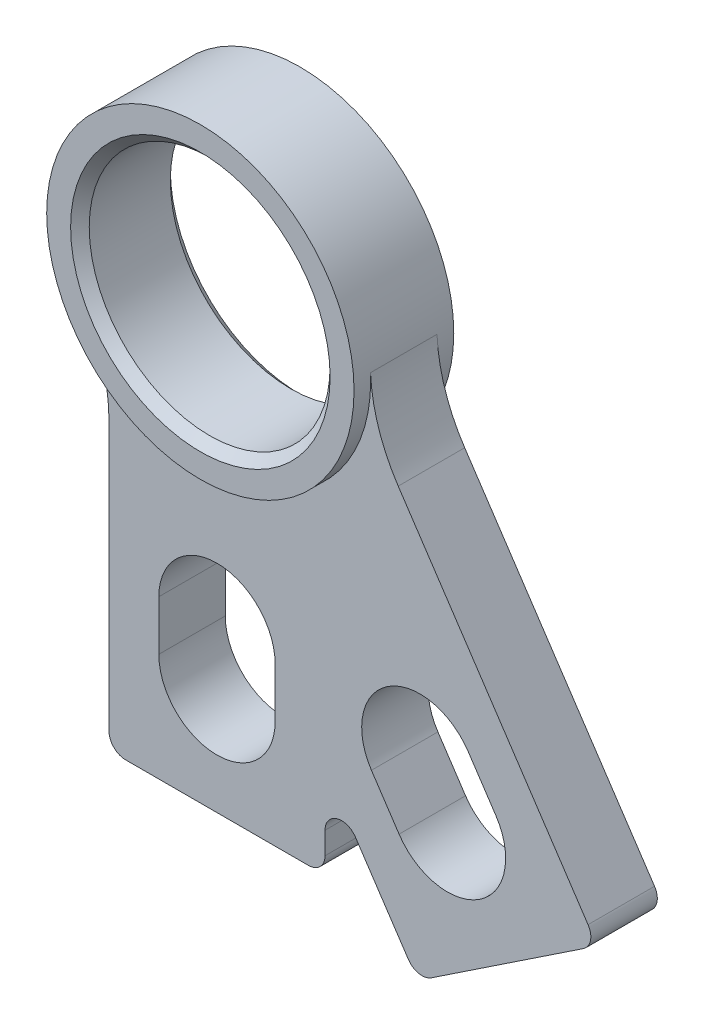
from build123d import *

# Parameters (mm, degrees)
SKETCH1_R           = 11.5062
BOSS_EXTRUDE2_DEPTH = 4.7625
BOSS_EXTRUDE3_DEPTH = 3.175
FILLET1_R           = 1.5875
CHAMFER1_SIZE       = 0.889


with BuildPart() as part:
    # Sketch1 → Boss-Extrude2 (new, symmetric)
    with BuildSketch(Plane.XY):
        with BuildLine():
            ThreePointArc((14.665064923, 0.688116436), (-4.253056447, 14.051659841), (-12.585193267, -7.559797873))
            ThreePointArc((-12.585193267, -7.559797873), (4.253056447, -14.051659841), (14.665064923, 0.688116436))
        make_face()
        Circle(SKETCH1_R, mode=Mode.SUBTRACT)
    extrude(amount=BOSS_EXTRUDE2_DEPTH, both=True)

    # Sketch1<4> → Boss-Extrude3 (add, symmetric)
    with BuildSketch(Plane.XY):
        with BuildLine():
            ThreePointArc((-12.585193267, -7.559797873), (-10.89585042, -11.492870345), (-10.31875, -15.734319794))
            Line((-10.31875, -15.734319794), (-10.31875, -43.039319794))
            Line((-10.31875, -43.039319794), (10.31875, -43.039319794))
            Line((10.31875, -43.039319794), (10.31875, -34.092085728))
            Line((10.31875, -34.092085728), (19.153867679, -47.350169222))
            Line((19.153867679, -47.350169222), (36.327460345, -35.905776657))
            Line((36.327460345, -35.905776657), (17.312161928, -7.371191919))
            ThreePointArc((17.312161928, -7.371191919), (15.440330311, -3.521622499), (14.665064923, 0.688116436))
            ThreePointArc((14.665064923, 0.688116436), (4.253056447, -14.051659841), (-12.585193267, -7.559797873))
        make_face()
        with BuildLine():
            ThreePointArc((5.55625, -32.720569794), (0, -38.276819794), (-5.55625, -32.720569794))
            Line((-5.55625, -32.720569794), (-5.55625, -27.958069794))
            ThreePointArc((-5.55625, -27.958069794), (0, -22.401819794), (5.55625, -27.958069794))
            Line((5.55625, -27.958069794), (5.55625, -32.720569794))
        make_face(mode=Mode.SUBTRACT)
        with BuildLine():
            ThreePointArc((26.642127293, -29.959993992), (25.099650343, -37.66483617), (17.394808165, -36.12235922))
            Line((17.394808165, -36.12235922), (14.753794496, -32.159222451))
            ThreePointArc((14.753794496, -32.159222451), (16.296271446, -24.454380273), (24.001113624, -25.996857223))
            Line((24.001113624, -25.996857223), (26.642127293, -29.959993992))
        make_face(mode=Mode.SUBTRACT)
    extrude(amount=BOSS_EXTRUDE3_DEPTH, both=True)

    # Fillet1
    fillet1_edges = [part.edges().sort_by_distance(p)[0] for p in [
        (-10.31875, -43.039319794, 0),
        (36.327460345, -35.905776657, 0),
        (10.31875, -43.039319794, 0),
        (19.153867679, -47.350169222, 0),
        (10.31875, -34.092085728, 0),
    ]]
    fillet(fillet1_edges, radius=FILLET1_R)

    # Chamfer1
    chamfer1_edges = [part.edges().sort_by_distance(p)[0] for p in [
        (-11.5062, 0, -4.7625),
        (-11.5062, 0, 4.7625),
    ]]
    chamfer(chamfer1_edges, length=CHAMFER1_SIZE)


solid = part.part
